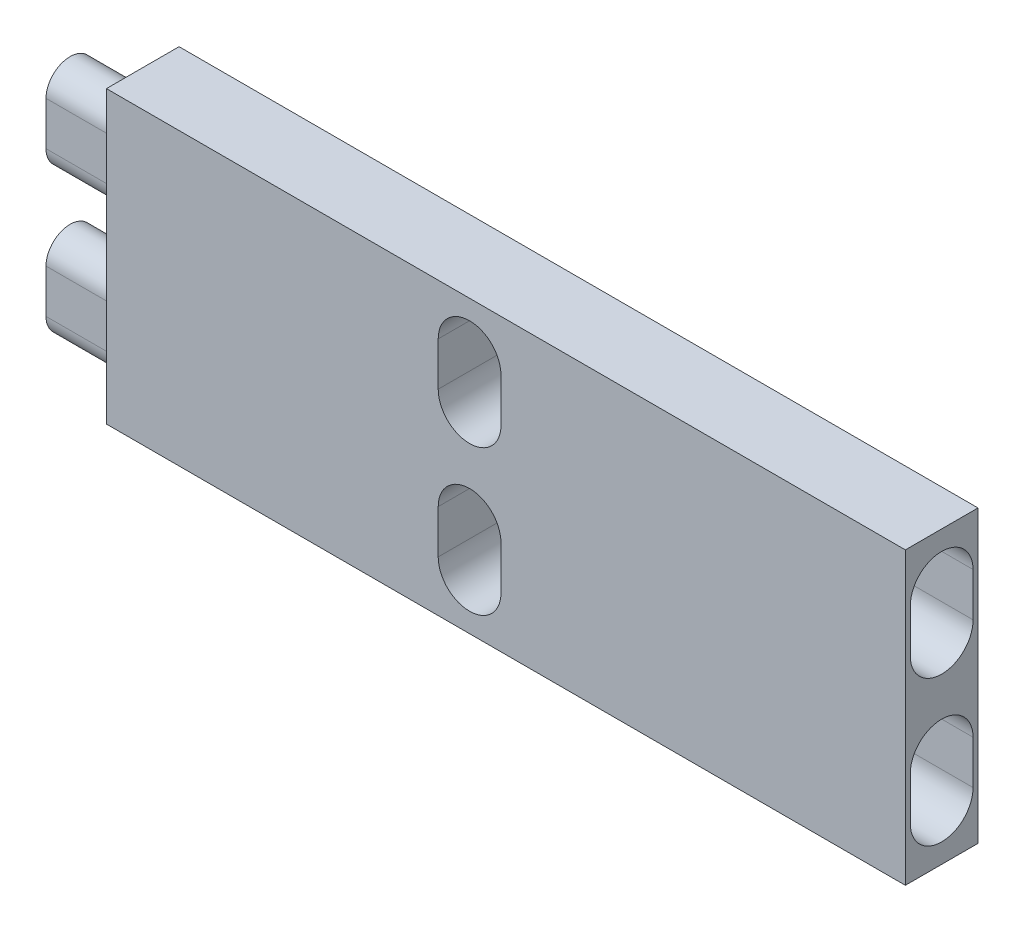
from build123d import *

# Parameters (mm, degrees)
SKETCH1_W           = 60
SKETCH1_H           = 20
BOSS_EXTRUDE1_DEPTH = 2.5
SKETCH2_W           = 5
SKETCH2_H           = 20
CUT_EXTRUDE1_DEPTH  = 5
CUT_EXTRUDE2_DEPTH  = 6
CUT_EXTRUDE3_DEPTH  = 6


with BuildPart() as part:
    # Sketch1 → Boss-Extrude1 (new, symmetric)
    with BuildSketch(Plane.XY):
        Rectangle(SKETCH1_W, SKETCH1_H)
    extrude(amount=BOSS_EXTRUDE1_DEPTH, both=True)

    # Sketch2 → Cut-Extrude1 (cut)
    with BuildSketch(Plane.ZY.offset(30)):
        Rectangle(SKETCH2_W, SKETCH2_H)
        with BuildLine():
            Line((1.66, 6.5), (1.66, 3.5))
            ThreePointArc((1.66, 3.5), (0, 1.84), (-1.66, 3.5))
            Line((-1.66, 3.5), (-1.66, 6.5))
            ThreePointArc((-1.66, 6.5), (0, 8.16), (1.66, 6.5))
        make_face(mode=Mode.SUBTRACT)
        with BuildLine():
            Line((1.66, -3.5), (1.66, -6.5))
            ThreePointArc((1.66, -6.5), (0, -8.16), (-1.66, -6.5))
            Line((-1.66, -6.5), (-1.66, -3.5))
            ThreePointArc((-1.66, -3.5), (0, -1.84), (1.66, -3.5))
        make_face(mode=Mode.SUBTRACT)
    extrude(amount=-CUT_EXTRUDE1_DEPTH, mode=Mode.SUBTRACT)

    # Sketch3 → Cut-Extrude2 (cut)
    with BuildSketch(Plane(origin=(30, 0, 0), x_dir=(0, 0, -1), z_dir=(1, 0, 0))):
        with BuildLine():
            Line((2.16, 3.5), (2.16, 6.5))
            ThreePointArc((2.16, 6.5), (0, 8.66), (-2.16, 6.5))
            Line((-2.16, 6.5), (-2.16, 3.5))
            ThreePointArc((-2.16, 3.5), (0, 1.34), (2.16, 3.5))
        make_face()
        with BuildLine():
            Line((2.16, -6.5), (2.16, -3.5))
            ThreePointArc((2.16, -3.5), (0, -1.34), (-2.16, -3.5))
            Line((-2.16, -3.5), (-2.16, -6.5))
            ThreePointArc((-2.16, -6.5), (0, -8.66), (2.16, -6.5))
        make_face()
    extrude(amount=-CUT_EXTRUDE2_DEPTH, mode=Mode.SUBTRACT)

    # Sketch4 → Cut-Extrude3 (cut)
    with BuildSketch(Plane(origin=(0, 0, -2.5), x_dir=(-1, 0, 0), z_dir=(0, 0, -1))):
        with BuildLine():
            Line((2.16, 6.5), (2.16, 3.5))
            ThreePointArc((2.16, 3.5), (0, 1.34), (-2.16, 3.5))
            Line((-2.16, 3.5), (-2.16, 6.5))
            ThreePointArc((-2.16, 6.5), (0, 8.66), (2.16, 6.5))
        make_face()
        with BuildLine():
            Line((-2.16, -6.5), (-2.16, -3.5))
            ThreePointArc((-2.16, -3.5), (0, -1.34), (2.16, -3.5))
            Line((2.16, -3.5), (2.16, -6.5))
            ThreePointArc((2.16, -6.5), (0, -8.66), (-2.16, -6.5))
        make_face()
    extrude(amount=-CUT_EXTRUDE3_DEPTH, mode=Mode.SUBTRACT)


solid = part.part
